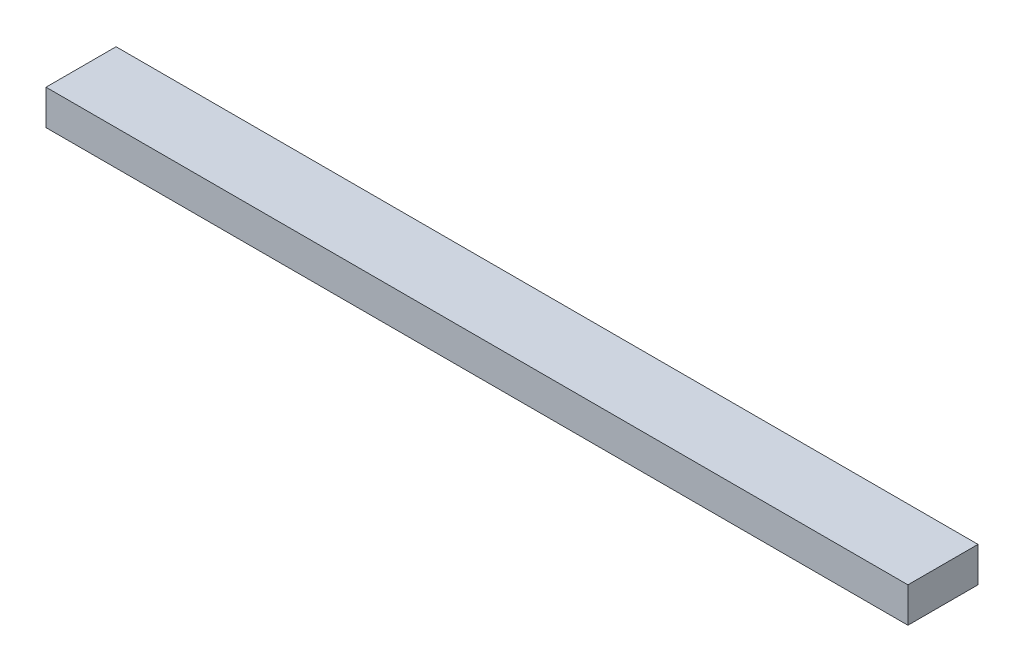
from build123d import *

# Parameters (mm, degrees)
SKETCH_1_W      = 246
SKETCH_1_H      = 20
EXTRUDE_1_DEPTH = 10


with BuildPart() as part:
    # Эскиз1 → Бобышка-Вытянуть1 (new body)
    with BuildSketch(Plane(origin=(0, 0, 0), x_dir=(1, 0, 0), z_dir=(0, 1, 0))):
        Rectangle(SKETCH_1_W, SKETCH_1_H)
    extrude(amount=EXTRUDE_1_DEPTH)


solid = part.part
